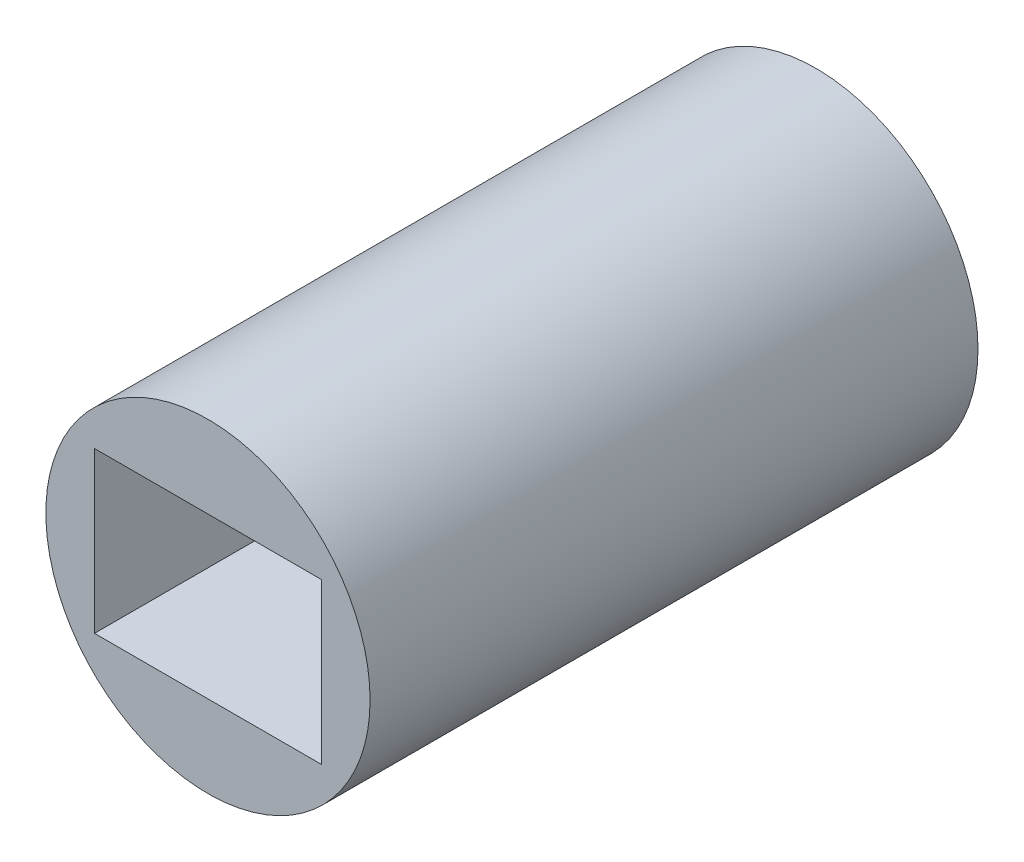
from build123d import *

# Parameters (mm, degrees)
SKETCH1_R           = 4
BOSS_EXTRUDE1_DEPTH = 15
SKETCH2_W           = 5.6
SKETCH2_H           = 3.95
CUT_EXTRUDE1_DEPTH  = 8
CUT_EXTRUDE2_DEPTH  = 7


with BuildPart() as part:
    # Sketch1 → Boss-Extrude1 (new body)
    with BuildSketch(Plane.XY):
        Circle(SKETCH1_R)
    extrude(amount=BOSS_EXTRUDE1_DEPTH)

    # Sketch2 → Cut-Extrude1 (cut)
    with BuildSketch(Plane.XY.offset(15)):
        Rectangle(SKETCH2_W, SKETCH2_H)
    extrude(amount=-CUT_EXTRUDE1_DEPTH, mode=Mode.SUBTRACT)

    # Sketch3 → Cut-Extrude2 (cut)
    with BuildSketch(Plane(origin=(0, 0, 0), x_dir=(-1, 0, 0), z_dir=(0, 0, -1))):
        with BuildLine():
            Line((0.948044642, -2.451135369), (0.948044642, -1.45))
            ThreePointArc((0.948044642, -1.45), (1.145326424, -1.147281782), (1.448044642, -0.95))
            Line((1.448044642, -0.95), (2.446909273, -0.95))
            ThreePointArc((2.446909273, -0.95), (2.561359119, 0), (2.446909273, 0.95))
            Line((2.446909273, 0.95), (1.445773904, 0.95))
            ThreePointArc((1.445773904, 0.95), (1.137533058, 1.141759153), (0.945773904, 1.45))
            Line((0.945773904, 1.45), (0.945773904, 2.448864631))
            ThreePointArc((0.945773904, 2.448864631), (-0.004226096, 2.563314477), (-0.954226096, 2.448864631))
            Line((-0.954226096, 2.448864631), (-0.954226096, 1.447729262))
            ThreePointArc((-0.954226096, 1.447729262), (-1.145985249, 1.139488415), (-1.454226096, 0.947729262))
            Line((-1.454226096, 0.947729262), (-2.453090727, 0.947729262))
            ThreePointArc((-2.453090727, 0.947729262), (-2.567540573, -0.002270738), (-2.453090727, -0.952270738))
            Line((-2.453090727, -0.952270738), (-1.451955358, -0.952270738))
            ThreePointArc((-1.451955358, -0.952270738), (-1.143714511, -1.144029891), (-0.951955358, -1.452270738))
            Line((-0.951955358, -1.452270738), (-0.951955358, -2.451135369))
            ThreePointArc((-0.951955358, -2.451135369), (-0.001955358, -2.565585215), (0.948044642, -2.451135369))
        make_face()
    extrude(amount=-CUT_EXTRUDE2_DEPTH, mode=Mode.SUBTRACT)


solid = part.part
